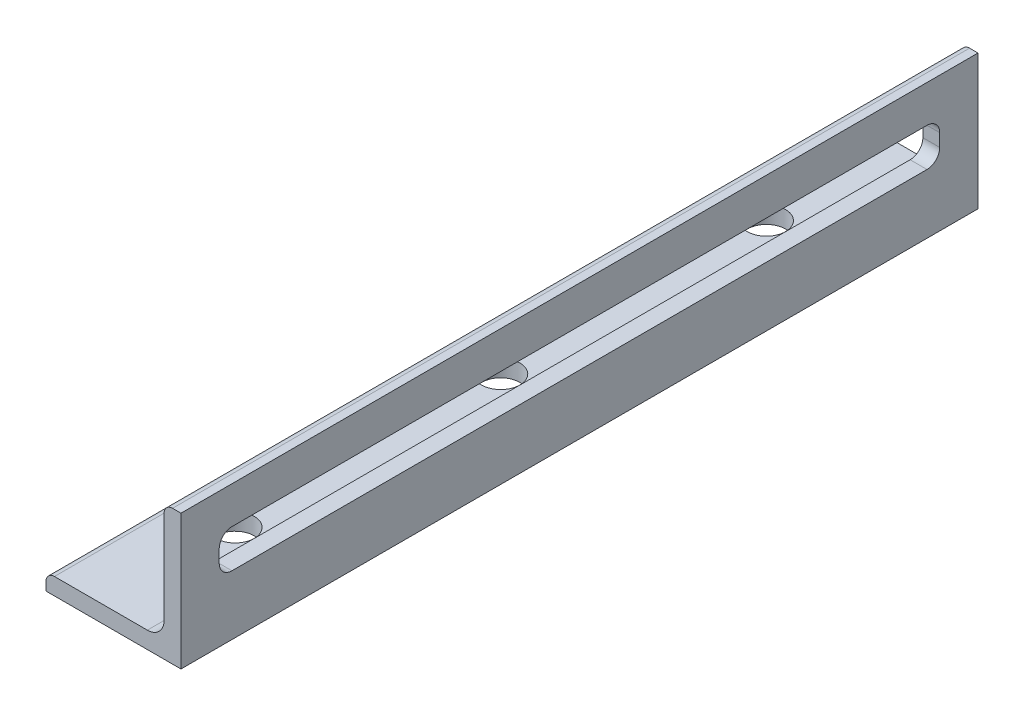
from build123d import *

# Parameters (mm, degrees)
BOSS_EXTRUDE1_DEPTH = 37.5
SKETCH3_R           = 1.8
CUT_EXTRUDE1_DEPTH  = 40.623984608
CUT_EXTRUDE2_DEPTH  = 40.623984608


with BuildPart() as part:
    # Sketch2 → Boss-Extrude1 (new, symmetric)
    with BuildSketch(Plane.XY):
        with BuildLine():
            Line((-6.35, -6.35), (6.35, -6.35))
            Line((6.35, -6.35), (6.35, 6.35))
            Line((6.35, 6.35), (5.55625, 6.35))
            ThreePointArc((5.55625, 6.35), (4.994983992, 6.117516008), (4.7625, 5.55625))
            Line((4.7625, 5.55625), (4.7625, -3.1877))
            ThreePointArc((4.7625, -3.1877), (4.301251759, -4.301251759), (3.1877, -4.7625))
            Line((3.1877, -4.7625), (-5.55625, -4.7625))
            ThreePointArc((-5.55625, -4.7625), (-6.117516008, -4.994983992), (-6.35, -5.55625))
            Line((-6.35, -5.55625), (-6.35, -6.35))
        make_face()
    extrude(amount=BOSS_EXTRUDE1_DEPTH, both=True)

    # Sketch3 → Cut-Extrude1 (cut, through all)
    with BuildSketch(Plane(origin=(0, -4.7625, 0), x_dir=(1, 0, 0), z_dir=(0, 1, 0))):
        with Locations(Location((-1.0623, 25, 0), (0, 0, 180))):
            Circle(SKETCH3_R)
        with Locations(Location((-1.0623, -25, 0), (0, 0, 180))):
            Circle(SKETCH3_R)
        with Locations(Location((-1.0623, 0, 0), (0, 0, 180))):
            Circle(SKETCH3_R)
    extrude(amount=-CUT_EXTRUDE1_DEPTH, mode=Mode.SUBTRACT)

    # Sketch4 → Cut-Extrude2 (cut, through all)
    with BuildSketch(Plane.ZY.offset(-4.7625)):
        with BuildLine():
            Line((-32.7, 2.85625), (32.7, 2.85625))
            ThreePointArc((32.7, 2.85625), (33.548528137, 2.504778137), (33.9, 1.65625))
            Line((33.9, 1.65625), (33.9, 0.45625))
            ThreePointArc((33.9, 0.45625), (33.548528137, -0.392278137), (32.7, -0.74375))
            Line((32.7, -0.74375), (-32.7, -0.74375))
            ThreePointArc((-32.7, -0.74375), (-33.548528137, -0.392278137), (-33.9, 0.45625))
            Line((-33.9, 0.45625), (-33.9, 1.65625))
            ThreePointArc((-33.9, 1.65625), (-33.548528137, 2.504778137), (-32.7, 2.85625))
        make_face()
    extrude(amount=-CUT_EXTRUDE2_DEPTH, mode=Mode.SUBTRACT)


solid = part.part
